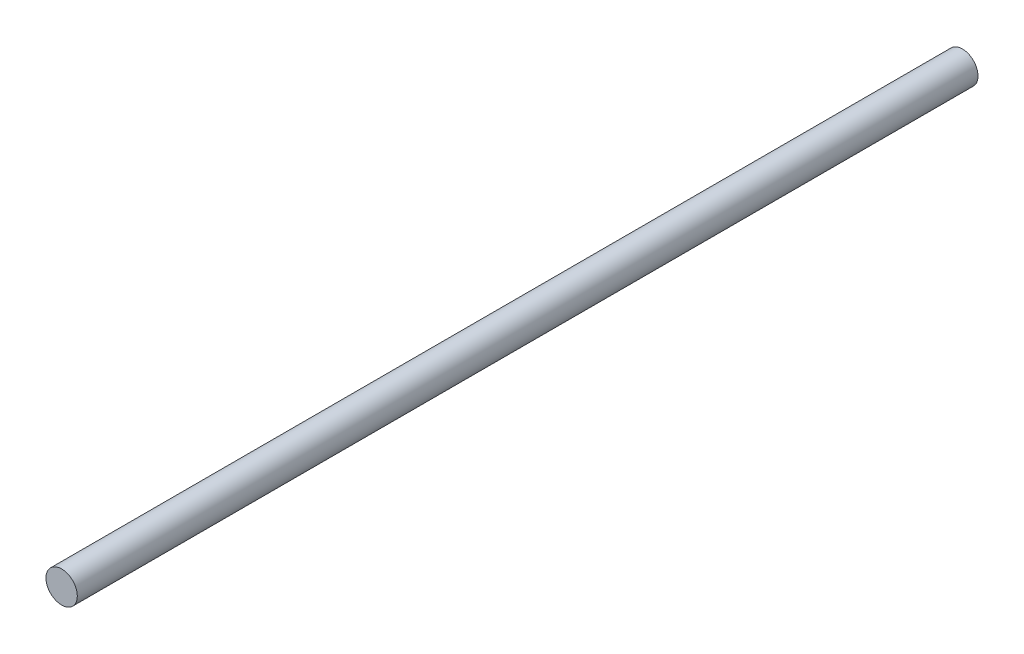
from build123d import *

# Parameters (mm, degrees)
SKETCH1_R           = 0.4
BOSS_EXTRUDE1_DEPTH = 23


with BuildPart() as part:
    # Sketch1 → Boss-Extrude1 (new body)
    with BuildSketch(Plane.XY):
        Circle(SKETCH1_R)
    extrude(amount=BOSS_EXTRUDE1_DEPTH)


solid = part.part
